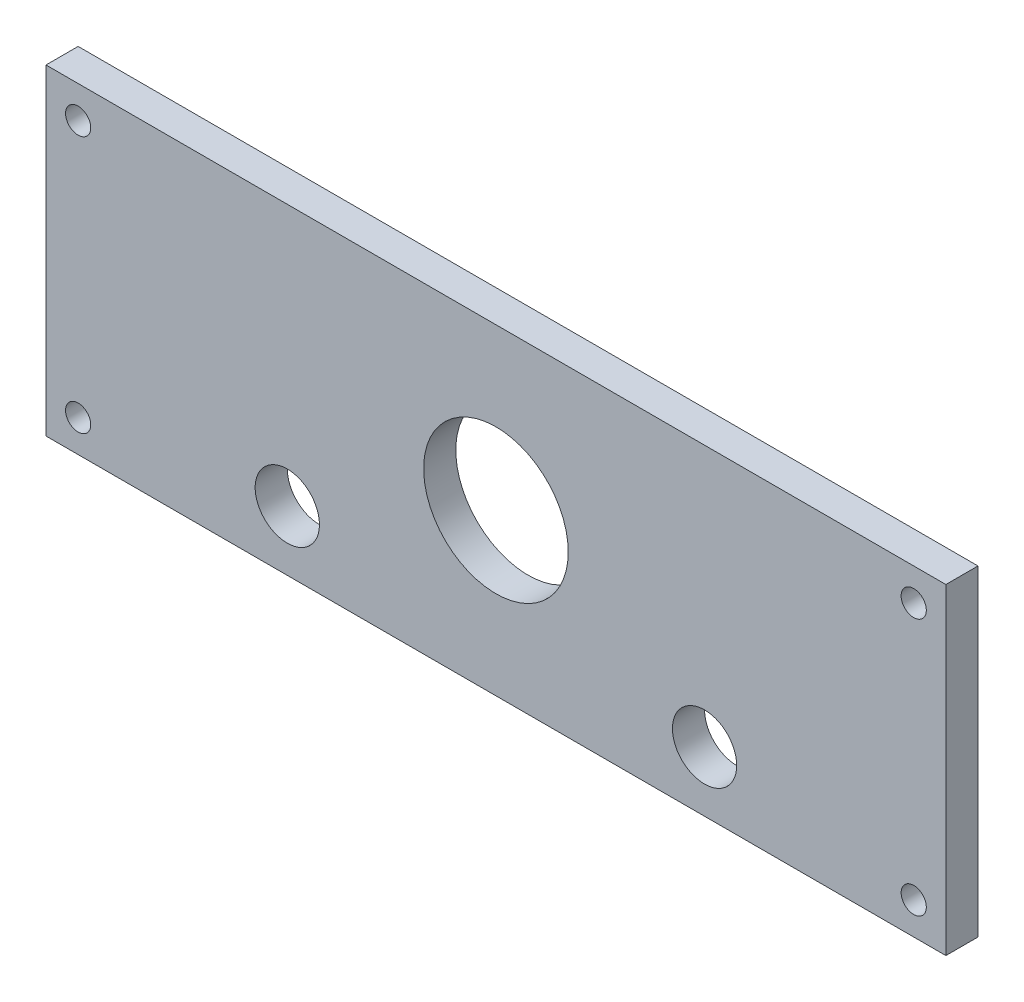
from build123d import *

# Parameters (mm, degrees)
SKETCH1_W                  = 177.8
SKETCH1_H                  = 63.5
SKETCH1_R                  = 6.35
SKETCH1_R_2                = 14.2875
BOSS_EXTRUDE2_DEPTH        = 6.35
F_9_0_196_DIAMETER_HOLE1_D = 4.9784


with BuildPart() as part:
    # Sketch1 → Boss-Extrude2 (new body)
    with BuildSketch(Plane.XY):
        with Locations((0, 49.5808)):
            Rectangle(SKETCH1_W, SKETCH1_H)
        with Locations((-41.221968309, 29.688201844)):
            Circle(SKETCH1_R, mode=Mode.SUBTRACT)
        with Locations((0, 49.5808)):
            Circle(SKETCH1_R_2, mode=Mode.SUBTRACT)
        with Locations((41.221968309, 29.688201844)):
            Circle(SKETCH1_R, mode=Mode.SUBTRACT)
    extrude(amount=BOSS_EXTRUDE2_DEPTH)

    # #9 (0.196) Diameter Hole1 (through all)
    with Locations(Plane(origin=(0, 0, 0), x_dir=(-1, 0, 0), z_dir=(0, 0, -1))):
        with Locations((-82.55, 74.9808), (-82.55, 24.1808), (82.55, 24.1808), (82.55, 74.9808)):
            Hole(F_9_0_196_DIAMETER_HOLE1_D / 2)


solid = part.part
